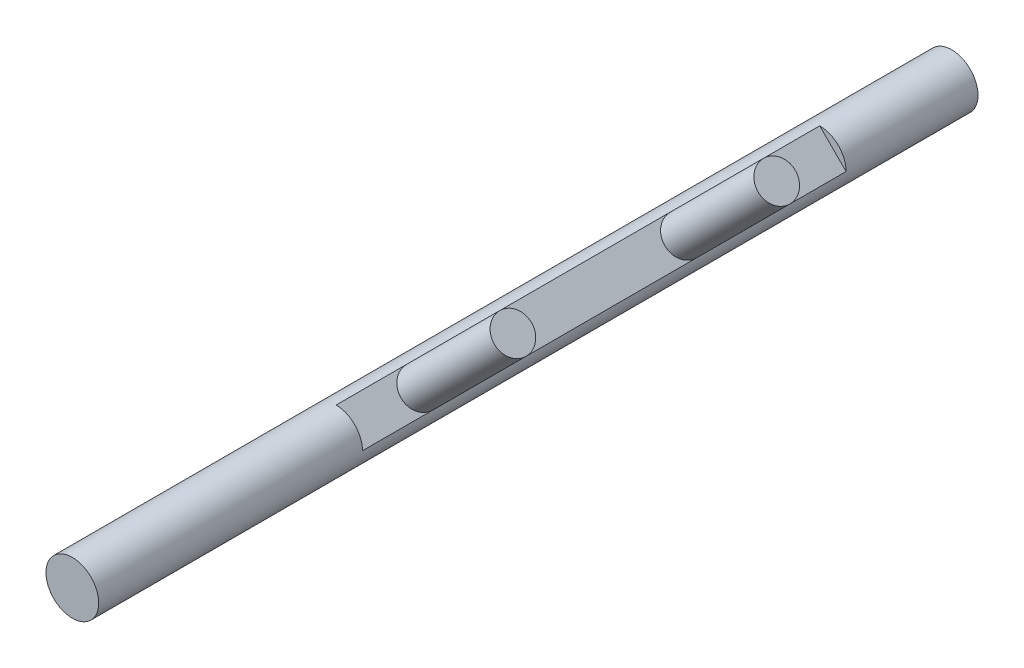
from build123d import *

# Parameters (mm, degrees)
ESQUISSE1_R             = 3
BOSS_EXTRU_1_DEPTH      = 15
ESQUISSE2_R             = 2.5
ENL_V_MAT_EXTRU_1_DEPTH = 5
BOSS_EXTRU_2_DEPTH      = 55
ESQUISSE4_R             = 2.121320344
BOSS_EXTRU_3_DEPTH      = 15
ESQUISSE5_R             = 3
BOSS_EXTRU_4_DEPTH      = 30


with BuildPart() as part:
    # Esquisse1 → Boss.-Extru.1 (new body)
    with BuildSketch(Plane.XY):
        Circle(ESQUISSE1_R)
    extrude(amount=BOSS_EXTRU_1_DEPTH)

    # Esquisse2 → Enlèv. mat.-Extru.1 (cut)
    with BuildSketch(Plane(origin=(0, 0, 0), x_dir=(-1, 0, 0), z_dir=(0, 0, -1))):
        Circle(ESQUISSE2_R)
    extrude(amount=-ENL_V_MAT_EXTRU_1_DEPTH, mode=Mode.SUBTRACT)

    # Esquisse3 → Boss.-Extru.2 (add)
    with BuildSketch(Plane.XY.offset(15)):
        with BuildLine():
            Line((0, 3), (3, 0))
            ThreePointArc((3, 0), (-2.121320344, -2.121320344), (0, 3))
        make_face()
    extrude(amount=BOSS_EXTRU_2_DEPTH)

    # Esquisse4 → Boss.-Extru.3 (add)
    with BuildSketch(Plane(origin=(1.5, 1.5, 0), x_dir=(0, 0, -1), z_dir=(0.7071067811865477, 0.7071067811865475, 0))):
        with Locations(Location((-62, 0, 0), (0, 0, 90))):
            Circle(ESQUISSE4_R)
        with Locations(Location((-32, 0, 0), (0, 0, 90))):
            Circle(ESQUISSE4_R)
    extrude(amount=BOSS_EXTRU_3_DEPTH)

    # Esquisse5 → Boss.-Extru.4 (add)
    with BuildSketch(Plane.XY.offset(70)):
        Circle(ESQUISSE5_R)
    extrude(amount=BOSS_EXTRU_4_DEPTH)


solid = part.part
